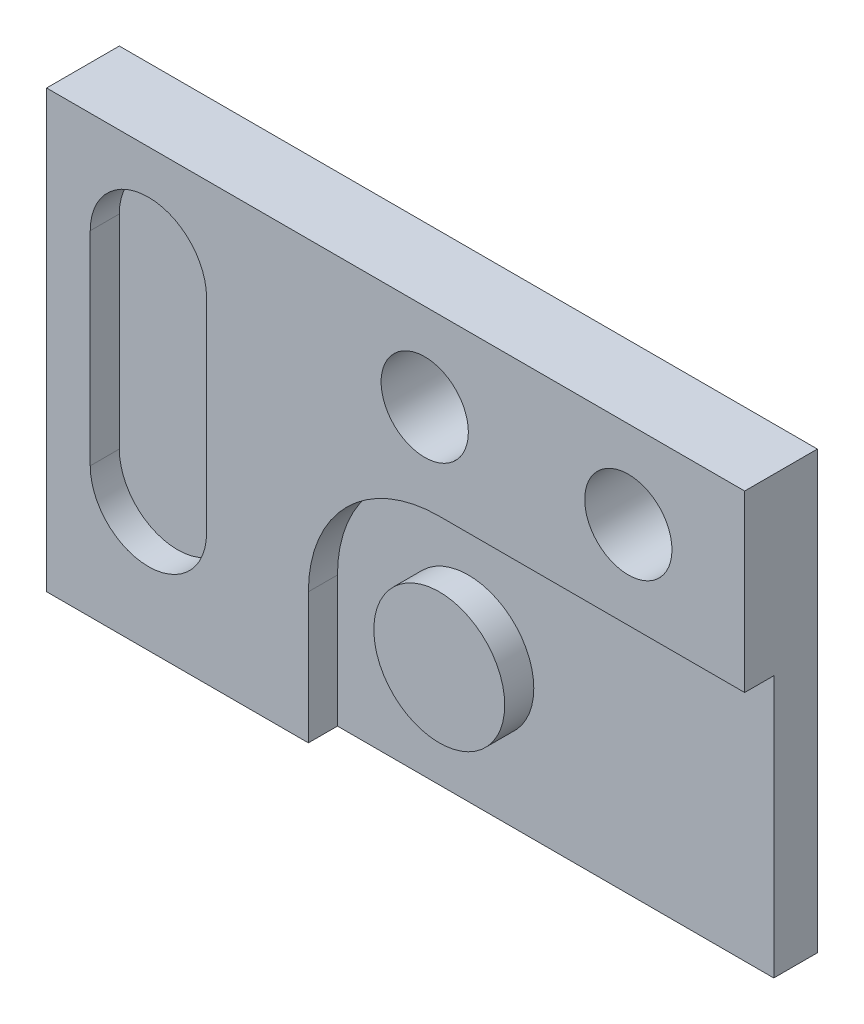
from build123d import *

# Parameters (mm, degrees)
SKETCH1_W           = 240
SKETCH1_H           = 150
BOSS_EXTRUDE1_DEPTH = 25
SKETCH2_R           = 15
SKETCH2_R_2         = 22.5
CUT_EXTRUDE1_DEPTH  = 10
SKETCH3_R           = 15
CUT_EXTRUDE2_DEPTH  = 143.302494708


with BuildPart() as part:
    # Sketch1 → Boss-Extrude1 (new body)
    with BuildSketch(Plane.XY):
        Rectangle(SKETCH1_W, SKETCH1_H)
    extrude(amount=BOSS_EXTRUDE1_DEPTH)

    # Sketch2 → Cut-Extrude1 (cut)
    # profile 1 of 4: a face of its own
    with BuildSketch(Plane.XY.offset(25)):
        with Locations((10, 45)):
            Circle(SKETCH2_R)
    # profile 2 of 4: a face of its own
    with BuildSketch(Plane.XY.offset(25)):
        with Locations((80, 45)):
            Circle(SKETCH2_R)
    # profile 3 of 4: a face of its own
    with BuildSketch(Plane.XY.offset(25)):
        with BuildLine():
            Line((-105, -30), (-105, 40))
            ThreePointArc((-105, 40), (-85, 60), (-65, 40))
            Line((-65, 40), (-65, -30))
            ThreePointArc((-65, -30), (-85, -50), (-105, -30))
        make_face()
    # profile 4 of 4: a face of its own
    with BuildSketch(Plane.XY.offset(25)):
        with BuildLine():
            Line((15, 15), (120, 15))
            Line((120, 15), (120, -75))
            Line((120, -75), (-30, -75))
            Line((-30, -75), (-30, -30))
            ThreePointArc((-30, -30), (-16.819805153, 1.819805153), (15, 15))
        make_face()
        with Locations((15, -30)):
            Circle(SKETCH2_R_2, mode=Mode.SUBTRACT)
    extrude(amount=-CUT_EXTRUDE1_DEPTH, mode=Mode.SUBTRACT)

    # Sketch3 → Cut-Extrude2 (cut, through all)
    with BuildSketch(Plane.XY.offset(15)):
        with Locations((10, 45)):
            Circle(SKETCH3_R)
        with Locations((80, 45)):
            Circle(SKETCH3_R)
    extrude(amount=-CUT_EXTRUDE2_DEPTH, mode=Mode.SUBTRACT)


solid = part.part
